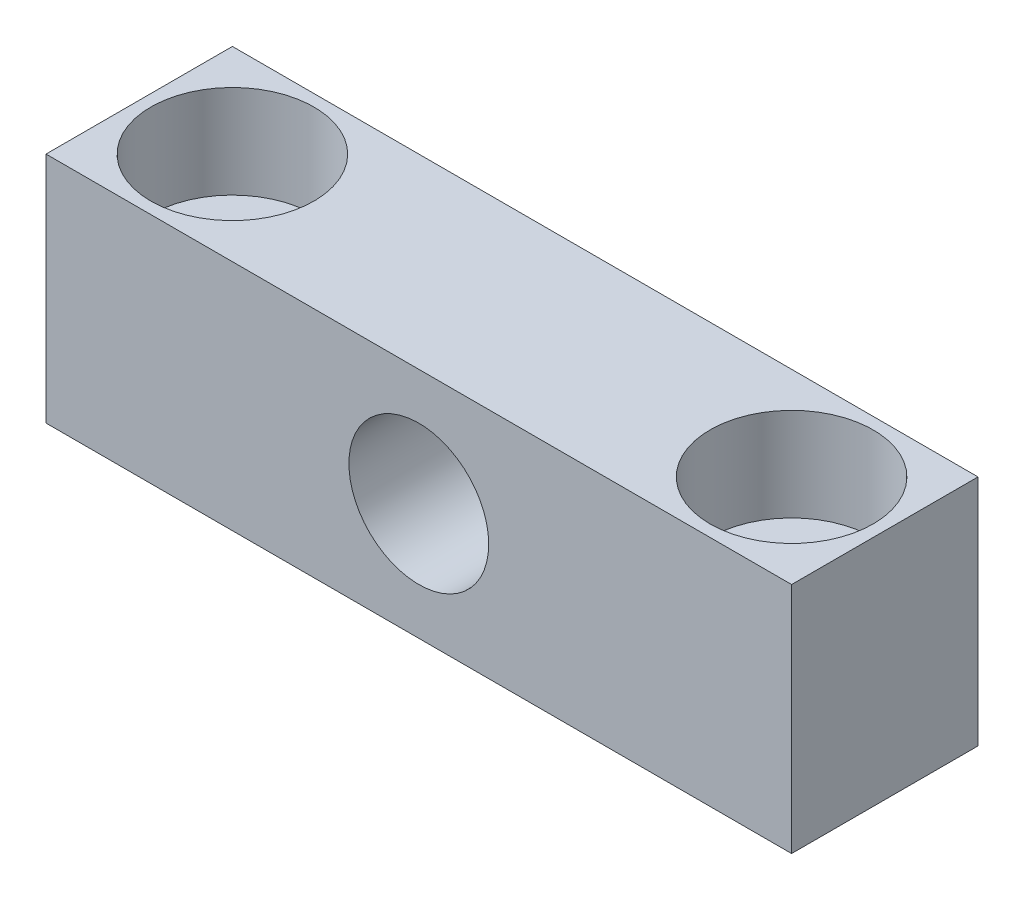
from build123d import *

# Parameters (mm, degrees)
SKETCH1_W                                        = 50.8
SKETCH1_H                                        = 12.7
EXTRUDE1_DEPTH                                   = 15.875
SKETCH3_R                                        = 4.7625
CUT_EXTRUDE2_DEPTH                               = 33.534068682
CBORE_FOR_1_4_SOCKET_HEAD_CAP_SCREW1_D           = 6.7564
CBORE_FOR_1_4_SOCKET_HEAD_CAP_SCREW1_CBORE_D     = 11.1125
CBORE_FOR_1_4_SOCKET_HEAD_CAP_SCREW1_CBORE_DEPTH = 6.35


with BuildPart() as part:
    # Sketch1 → Extrude1 (new body)
    with BuildSketch(Plane(origin=(0, 0, 0), x_dir=(1, 0, 0), z_dir=(0, 1, 0))):
        Rectangle(SKETCH1_W, SKETCH1_H)
    extrude(amount=EXTRUDE1_DEPTH)

    # Sketch3 → Cut-Extrude2 (cut, through all)
    with BuildSketch(Plane.XY.offset(6.35)):
        with Locations((0, 7.9375)):
            Circle(SKETCH3_R)
    extrude(amount=-CUT_EXTRUDE2_DEPTH, mode=Mode.SUBTRACT)

    # CBORE for 1/4 Socket Head Cap Screw1 (through all)
    with Locations(Plane(origin=(0, 15.875, 0), x_dir=(-1, 0, 0), z_dir=(0, 1, 0))):
        with Locations((-19.05, 0), (19.05, 0)):
            CounterBoreHole(CBORE_FOR_1_4_SOCKET_HEAD_CAP_SCREW1_D / 2, CBORE_FOR_1_4_SOCKET_HEAD_CAP_SCREW1_CBORE_D / 2, CBORE_FOR_1_4_SOCKET_HEAD_CAP_SCREW1_CBORE_DEPTH)


solid = part.part
